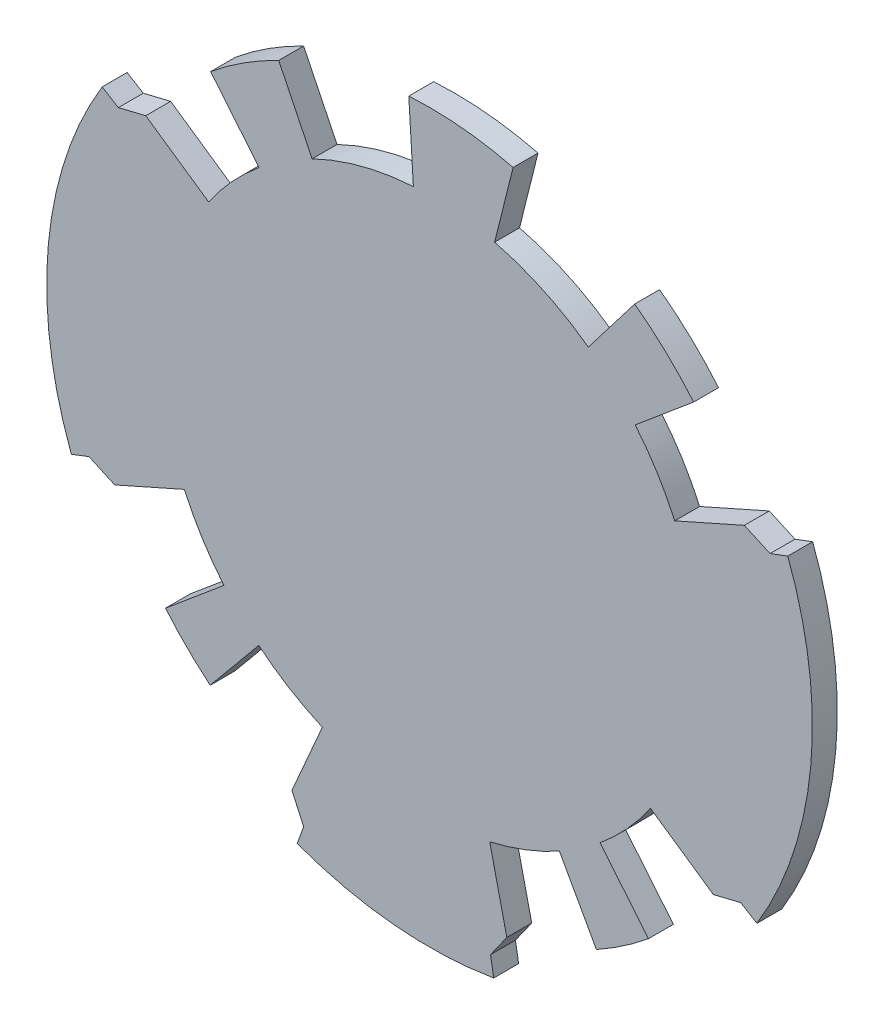
from build123d import *

# Parameters (mm, degrees)
BOSS_EXTRUDE1_DEPTH = 3.25


with BuildPart() as part:
    # Sketch1 → Boss-Extrude1 (new body)
    with BuildSketch(Plane.XY):
        with BuildLine():
            ThreePointArc((-17.274850221, -46.867047521), (-4.606545813, -49.736509017), (8.373275125, -49.242551286))
            Line((8.373275125, -49.242551286), (7.956694327, -46.80760748))
            Line((7.956694327, -46.80760748), (10.082748433, -43.803937887))
            Line((10.082748433, -43.803937887), (7.850969083, -34.108097051))
            ThreePointArc((7.850969083, -34.108097051), (12.521493626, -32.683515682), (16.948301539, -30.622786858))
            Line((16.948301539, -30.622786858), (21.766161472, -39.327865505))
            ThreePointArc((21.766161472, -39.327865505), (25.270761666, -37.173046623), (28.563666386, -34.70682574))
            Line((28.563666386, -34.70682574), (22.241203696, -27.02459728))
            ThreePointArc((22.241203696, -27.02459728), (25.785850836, -23.66621847), (28.828605721, -19.847203637))
            Line((28.828605721, -19.847203637), (37.023656069, -25.489128697))
            Line((37.023656069, -25.489128697), (40.598794027, -24.617047471))
            Line((40.598794027, -24.617047471), (42.709771039, -25.900116821))
            ThreePointArc((42.709771039, -25.900116821), (49.736509017, -4.606545813), (46.74013071, 17.615356218))
            Line((46.74013071, 17.615356218), (44.429411044, 16.741820001))
            Line((44.429411044, 16.741820001), (41.075257073, 18.255685327))
            Line((41.075257073, 18.255685327), (31.983399718, 14.214856401))
            ThreePointArc((31.983399718, 14.214856401), (29.693813825, 18.527747314), (26.826271623, 22.4800167))
            Line((26.826271623, 22.4800167), (34.452122443, 28.870366287))
            ThreePointArc((34.452122443, 28.870366287), (30.822303091, 32.717463571), (26.765708371, 36.111544495))
            Line((26.765708371, 36.111544495), (20.716316478, 28.210534054))
            ThreePointArc((20.716316478, 28.210534054), (14.882671096, 31.67816442), (8.489487351, 33.954802378))
            Line((8.489487351, 33.954802378), (10.902777017, 43.607066443))
            ThreePointArc((10.902777017, 43.607066443), (4.145424396, 44.757817719), (-2.708331204, 44.867713698))
            Line((-2.708331204, 44.867713698), (-2.108852035, 34.936409991))
            ThreePointArc((-2.108852035, 34.936409991), (-8.886502223, 33.853066009), (-15.322401648, 31.467824961))
            Line((-15.322401648, 31.467824961), (-19.678070256, 40.413120907))
            ThreePointArc((-19.678070256, 40.413120907), (-24.289025087, 37.82181977), (-28.563666386, 34.70682574))
            Line((-28.563666386, 34.70682574), (-22.241203696, 27.02459728))
            ThreePointArc((-22.241203696, 27.02459728), (-25.785850836, 23.66621847), (-28.828605721, 19.847203637))
            Line((-28.828605721, 19.847203637), (-37.023656069, 25.489128697))
            Line((-37.023656069, 25.489128697), (-40.598794027, 24.617047471))
            Line((-40.598794027, 24.617047471), (-42.709771039, 25.900116821))
            ThreePointArc((-42.709771039, 25.900116821), (-49.736509017, 4.606545813), (-46.74013071, -17.615356218))
            Line((-46.74013071, -17.615356218), (-44.429411044, -16.741820001))
            Line((-44.429411044, -16.741820001), (-41.075257073, -18.255685327))
            Line((-41.075257073, -18.255685327), (-31.983399718, -14.214856401))
            ThreePointArc((-31.983399718, -14.214856401), (-29.693813825, -18.527747314), (-26.826271623, -22.4800167))
            Line((-26.826271623, -22.4800167), (-34.452122443, -28.870366287))
            ThreePointArc((-34.452122443, -28.870366287), (-31.668184411, -31.899418279), (-28.61895911, -34.661245936))
            Line((-28.61895911, -34.661245936), (-22.284257579, -26.989106398))
            ThreePointArc((-22.284257579, -26.989106398), (-18.311231086, -29.8278195), (-13.981797309, -32.085968023))
            Line((-13.981797309, -32.085968023), (-17.956374991, -41.206982267))
            Line((-17.956374991, -41.206982267), (-16.418147872, -44.550033929))
            Line((-16.418147872, -44.550033929), (-17.274850221, -46.867047521))
        make_face()
    extrude(amount=-BOSS_EXTRUDE1_DEPTH)


solid = part.part
